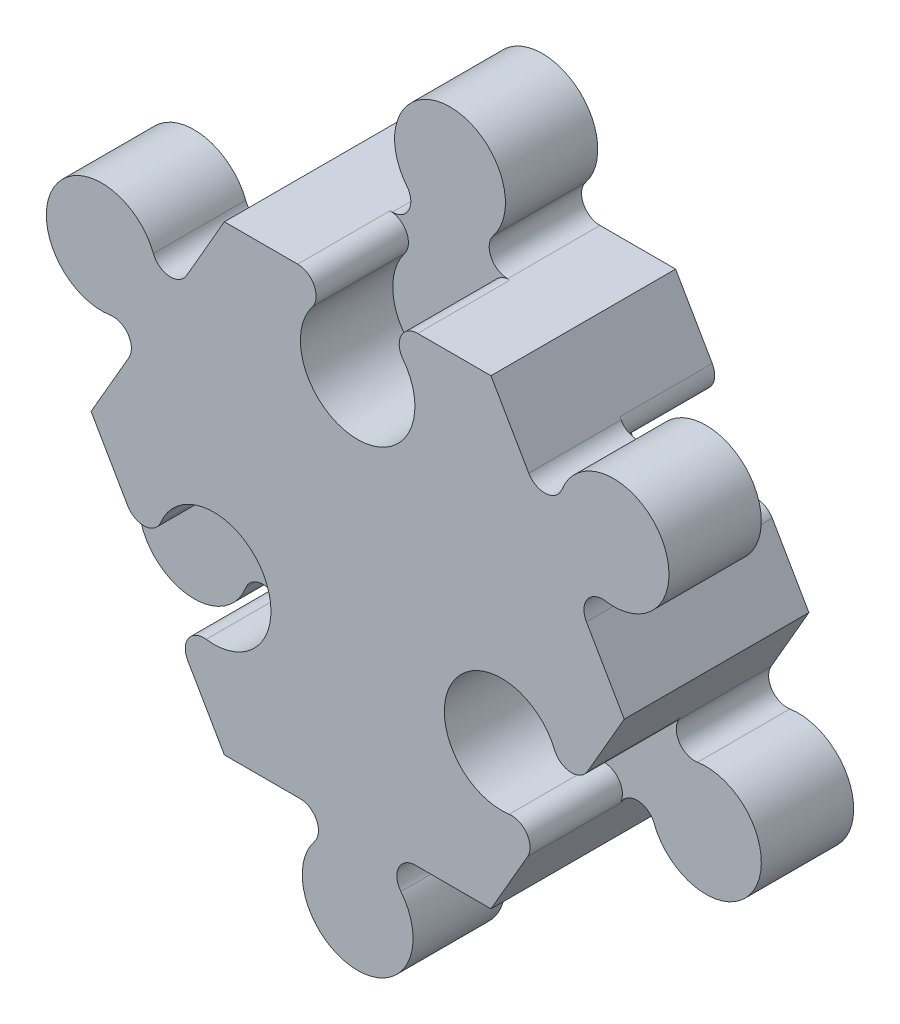
from build123d import *

# Parameters (mm, degrees)
EXTRUDE_1_DEPTH          = 10
EXTRUDE_2_DEPTH          = 5
CUT_EXTRUDE_2_DEPTH      = 5
PATTERN_CIRCULAR_1_COUNT = 3
EXTRUDE_3_DEPTH          = 5
CUT_EXTRUDE_3_DEPTH      = 5


with BuildPart() as part:
    # 草图1 → 凸台-拉伸1 (new body)
    with BuildSketch(Plane.XY):
        Polygon((14.43375673, 0), (7.216878365, 12.5), (-7.216878365, 12.5), (-14.43375673, 0), (-7.216878365, -12.5), (7.216878365, -12.5), align=None)
    extrude(amount=EXTRUDE_1_DEPTH)

    # 草图2 → 凸台-拉伸2 (add)
    with BuildSketch(Plane(origin=(0, 0, 0), x_dir=(-1, 0, 0), z_dir=(0, 0, -1))):
        with BuildLine():
            Line((-3.122498999, 12.5), (3.122498999, 12.5))
            ThreePointArc((3.122498999, 12.5), (2.22111118, 13.066987298), (2.341874249, 14.125))
            ThreePointArc((2.341874249, 14.125), (0, 19), (-2.341874249, 14.125))
            ThreePointArc((-2.341874249, 14.125), (-2.22111118, 13.066987298), (-3.122498999, 12.5))
        make_face()
    extrude_2 = extrude(amount=-EXTRUDE_2_DEPTH)

    # 草图3 → 切除-拉伸2 (cut)
    with BuildSketch(Plane(origin=(0, 0, 0), x_dir=(-1, 0, 0), z_dir=(0, 0, -1))):
        with BuildLine():
            ThreePointArc((-2.457026249, -10.890243902), (-2.352465403, -11.941726104), (-3.249615362, -12.5))
            Line((-3.249615362, -12.5), (0, -12.5))
            Line((0, -12.5), (3.249615362, -12.5))
            ThreePointArc((3.249615362, -12.5), (2.352465403, -11.941726104), (2.457026249, -10.890243902))
            ThreePointArc((2.457026249, -10.890243902), (0, -5.9), (-2.457026249, -10.890243902))
        make_face()
    cut_extrude_2 = extrude(amount=-CUT_EXTRUDE_2_DEPTH, mode=Mode.SUBTRACT)

    # 阵列(圆周)1: 凸台-拉伸2, 切除-拉伸2 ×3 about axis
    pattern_circular_1_axis = Axis((0, 0, 0), (0, 0, -1))
    add([extrude_2.rotate(pattern_circular_1_axis, i * 360 / PATTERN_CIRCULAR_1_COUNT) for i in range(1, PATTERN_CIRCULAR_1_COUNT)])
    add([cut_extrude_2.rotate(pattern_circular_1_axis, i * 360 / PATTERN_CIRCULAR_1_COUNT) for i in range(1, PATTERN_CIRCULAR_1_COUNT)], mode=Mode.SUBTRACT)

    # 草图5 → 凸台-拉伸3 (add)
    with BuildSketch(Plane.XY.offset(10)):
        with BuildLine():
            Line((7.216878365, -12.5), (9.200509866, -9.064249456))
            ThreePointArc((9.200509866, -9.064249456), (9.16560547, -8.008157853), (8.202714748, -7.572969101))
            ThreePointArc((8.202714748, -7.572969101), (5.109549882, -2.95), (10.659740998, -3.317274802))
            ThreePointArc((10.659740998, -3.317274802), (11.518070873, -3.933568252), (12.450125228, -3.435750544))
            Line((12.450125228, -3.435750544), (14.43375673, 0))
            Line((14.43375673, 0), (12.386567047, 3.545836543))
            ThreePointArc((12.386567047, 3.545836543), (12.426898541, 4.609954942), (13.403545953, 5.034377408))
            ThreePointArc((13.403545953, 5.034377408), (16.454482672, 9.5), (11.061671704, 9.090622592))
            ThreePointArc((11.061671704, 9.090622592), (10.205787361, 8.457032356), (9.264068048, 8.954163457))
            Line((9.264068048, 8.954163457), (7.216878365, 12.5))
            Line((7.216878365, 12.5), (3.249615362, 12.5))
            ThreePointArc((3.249615362, 12.5), (2.352465403, 11.941726104), (2.457026249, 10.890243902))
            ThreePointArc((2.457026249, 10.890243902), (0, 5.9), (-2.457026249, 10.890243902))
            ThreePointArc((-2.457026249, 10.890243902), (-2.352465403, 11.941726104), (-3.249615362, 12.5))
            Line((-3.249615362, 12.5), (-7.216878365, 12.5))
            Line((-7.216878365, 12.5), (-9.264068048, 8.954163457))
            ThreePointArc((-9.264068048, 8.954163457), (-10.205787361, 8.457032356), (-11.061671704, 9.090622592))
            ThreePointArc((-11.061671704, 9.090622592), (-16.454482672, 9.5), (-13.403545953, 5.034377408))
            ThreePointArc((-13.403545953, 5.034377408), (-12.426898541, 4.609954942), (-12.386567047, 3.545836543))
            Line((-12.386567047, 3.545836543), (-14.43375673, 0))
            Line((-14.43375673, 0), (-12.450125228, -3.435750544))
            ThreePointArc((-12.450125228, -3.435750544), (-11.518070873, -3.933568252), (-10.659740998, -3.317274802))
            ThreePointArc((-10.659740998, -3.317274802), (-5.109549882, -2.95), (-8.202714748, -7.572969101))
            ThreePointArc((-8.202714748, -7.572969101), (-9.16560547, -8.008157853), (-9.200509866, -9.064249456))
            Line((-9.200509866, -9.064249456), (-7.216878365, -12.5))
            Line((-7.216878365, -12.5), (-3.122498999, -12.5))
            ThreePointArc((-3.122498999, -12.5), (-2.22111118, -13.066987298), (-2.341874249, -14.125))
            ThreePointArc((-2.341874249, -14.125), (0, -19), (2.341874249, -14.125))
            ThreePointArc((2.341874249, -14.125), (2.22111118, -13.066987298), (3.122498999, -12.5))
            Line((3.122498999, -12.5), (7.216878365, -12.5))
        make_face()
    extrude(amount=-EXTRUDE_3_DEPTH)

    # 草图6 → 切除-拉伸3 (cut)
    with BuildSketch(Plane.XY.offset(10)):
        Polygon((26.179583505, 0.365011735), (12.773682317, 22.854690243), (-13.405901188, 22.489678508), (-26.179583505, -0.365011735), (-12.773682317, -22.854690243), (13.405901188, -22.489678508), align=None)
        with BuildLine():
            Line((7.216878365, -12.5), (9.200509866, -9.064249456))
            ThreePointArc((9.200509866, -9.064249456), (9.16560547, -8.008157853), (8.202714748, -7.572969101))
            ThreePointArc((8.202714748, -7.572969101), (5.109549882, -2.95), (10.659740998, -3.317274802))
            ThreePointArc((10.659740998, -3.317274802), (11.518070873, -3.933568252), (12.450125228, -3.435750544))
            Line((12.450125228, -3.435750544), (14.43375673, 0))
            Line((14.43375673, 0), (12.386567047, 3.545836543))
            ThreePointArc((12.386567047, 3.545836543), (12.426898541, 4.609954942), (13.403545953, 5.034377408))
            ThreePointArc((13.403545953, 5.034377408), (16.454482672, 9.5), (11.061671704, 9.090622592))
            ThreePointArc((11.061671704, 9.090622592), (10.205787361, 8.457032356), (9.264068048, 8.954163457))
            Line((9.264068048, 8.954163457), (7.216878365, 12.5))
            Line((7.216878365, 12.5), (3.249615362, 12.5))
            ThreePointArc((3.249615362, 12.5), (2.352465403, 11.941726104), (2.457026249, 10.890243902))
            ThreePointArc((2.457026249, 10.890243902), (0, 5.9), (-2.457026249, 10.890243902))
            ThreePointArc((-2.457026249, 10.890243902), (-2.352465403, 11.941726104), (-3.249615362, 12.5))
            Line((-3.249615362, 12.5), (-7.216878365, 12.5))
            Line((-7.216878365, 12.5), (-9.264068048, 8.954163457))
            ThreePointArc((-9.264068048, 8.954163457), (-10.205787361, 8.457032356), (-11.061671704, 9.090622592))
            ThreePointArc((-11.061671704, 9.090622592), (-16.454482672, 9.5), (-13.403545953, 5.034377408))
            ThreePointArc((-13.403545953, 5.034377408), (-12.426898541, 4.609954942), (-12.386567047, 3.545836543))
            Line((-12.386567047, 3.545836543), (-14.43375673, 0))
            Line((-14.43375673, 0), (-12.450125228, -3.435750544))
            ThreePointArc((-12.450125228, -3.435750544), (-11.518070873, -3.933568252), (-10.659740998, -3.317274802))
            ThreePointArc((-10.659740998, -3.317274802), (-5.109549882, -2.95), (-8.202714748, -7.572969101))
            ThreePointArc((-8.202714748, -7.572969101), (-9.16560547, -8.008157853), (-9.200509866, -9.064249456))
            Line((-9.200509866, -9.064249456), (-7.216878365, -12.5))
            Line((-7.216878365, -12.5), (-3.122498999, -12.5))
            ThreePointArc((-3.122498999, -12.5), (-2.22111118, -13.066987298), (-2.341874249, -14.125))
            ThreePointArc((-2.341874249, -14.125), (0, -19), (2.341874249, -14.125))
            ThreePointArc((2.341874249, -14.125), (2.22111118, -13.066987298), (3.122498999, -12.5))
            Line((3.122498999, -12.5), (7.216878365, -12.5))
        make_face(mode=Mode.SUBTRACT)
    extrude(amount=-CUT_EXTRUDE_3_DEPTH, mode=Mode.SUBTRACT)


solid = part.part
